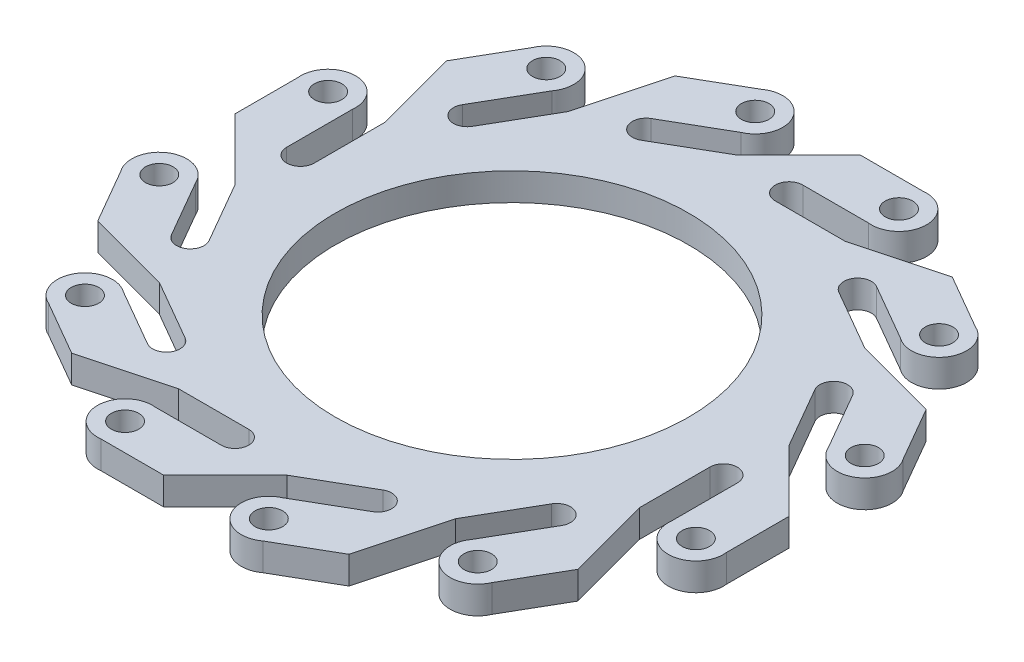
from build123d import *

# Parameters (mm, degrees)
SKETCH_1_R      = 1
SKETCH_1_R_2    = 12.835097572
EXTRUDE_1_DEPTH = 2


with BuildPart() as part:
    # 草图1 → 凸台-拉伸1 (new body)
    with BuildSketch(Plane(origin=(0, 0, 0), x_dir=(1, 0, 0), z_dir=(0, 1, 0))):
        with BuildLine():
            Line((7.150459564, 22.71458211), (2.584896164, 22.71458211))
            Line((2.584896164, 22.71458211), (-1.893440977, 18.236244969))
            Line((-1.893440977, 18.236244969), (-6.310791907, 15.68588622))
            ThreePointArc((-6.310791907, 15.68588622), (-7.676817311, 16.051911624), (-7.310791907, 17.417937028))
            Line((-7.310791907, 17.417937028), (-3.177406319, 19.80434831))
            ThreePointArc((-3.177406319, 19.80434831), (-2.244981501, 22.637541774), (-5.164811424, 23.246634926))
            Line((-5.164811424, 23.246634926), (-9.118705311, 20.963853226))
            Line((-9.118705311, 20.963853226), (-10.757890471, 14.846330924))
            Line((-10.757890471, 14.846330924), (-13.30824922, 10.428979994))
            ThreePointArc((-13.30824922, 10.428979994), (-14.674274623, 10.06295459), (-15.040300027, 11.428979994))
            Line((-15.040300027, 11.428979994), (-12.653888745, 15.562365582))
            ThreePointArc((-12.653888745, 15.562365582), (-13.262981897, 18.482195505), (-16.096175362, 17.549770686))
            Line((-16.096175362, 17.549770686), (-18.378957062, 13.5958768))
            Line((-18.378957062, 13.5958768), (-16.739771901, 7.478354497))
            Line((-16.739771901, 7.478354497), (-16.739771901, 2.377637001))
            ThreePointArc((-16.739771901, 2.377637001), (-17.739771901, 1.377637001), (-18.739771901, 2.377637001))
            Line((-18.739771901, 2.377637001), (-18.739771901, 7.150459564))
            ThreePointArc((-18.739771901, 7.150459564), (-20.727177006, 9.374559877), (-22.71458211, 7.150459564))
            Line((-22.71458211, 7.150459564), (-22.71458211, 2.584896164))
            Line((-22.71458211, 2.584896164), (-18.236244969, -1.893440977))
            Line((-18.236244969, -1.893440977), (-15.68588622, -6.310791907))
            ThreePointArc((-15.68588622, -6.310791907), (-16.051911624, -7.676817311), (-17.417937028, -7.310791907))
            Line((-17.417937028, -7.310791907), (-19.80434831, -3.177406319))
            ThreePointArc((-19.80434831, -3.177406319), (-22.637541774, -2.244981501), (-23.246634926, -5.164811424))
            Line((-23.246634926, -5.164811424), (-20.963853226, -9.118705311))
            Line((-20.963853226, -9.118705311), (-14.846330924, -10.757890471))
            Line((-14.846330924, -10.757890471), (-10.428979994, -13.30824922))
            ThreePointArc((-10.428979994, -13.30824922), (-10.06295459, -14.674274623), (-11.428979994, -15.040300027))
            Line((-11.428979994, -15.040300027), (-15.562365582, -12.653888745))
            ThreePointArc((-15.562365582, -12.653888745), (-18.482195505, -13.262981897), (-17.549770686, -16.096175362))
            Line((-17.549770686, -16.096175362), (-13.5958768, -18.378957062))
            Line((-13.5958768, -18.378957062), (-7.478354497, -16.739771901))
            Line((-7.478354497, -16.739771901), (-2.377637001, -16.739771901))
            ThreePointArc((-2.377637001, -16.739771901), (-1.377637001, -17.739771901), (-2.377637001, -18.739771901))
            Line((-2.377637001, -18.739771901), (-7.150459564, -18.739771901))
            ThreePointArc((-7.150459564, -18.739771901), (-9.374559877, -20.727177006), (-7.150459564, -22.71458211))
            Line((-7.150459564, -22.71458211), (-2.584896164, -22.71458211))
            Line((-2.584896164, -22.71458211), (1.893440977, -18.236244969))
            Line((1.893440977, -18.236244969), (6.310791907, -15.68588622))
            ThreePointArc((6.310791907, -15.68588622), (7.676817311, -16.051911624), (7.310791907, -17.417937028))
            Line((7.310791907, -17.417937028), (3.177406319, -19.80434831))
            ThreePointArc((3.177406319, -19.80434831), (2.244981501, -22.637541774), (5.164811424, -23.246634926))
            Line((5.164811424, -23.246634926), (9.118705311, -20.963853226))
            Line((9.118705311, -20.963853226), (10.757890471, -14.846330924))
            Line((10.757890471, -14.846330924), (13.30824922, -10.428979994))
            ThreePointArc((13.30824922, -10.428979994), (14.674274623, -10.06295459), (15.040300027, -11.428979994))
            Line((15.040300027, -11.428979994), (12.653888745, -15.562365582))
            ThreePointArc((12.653888745, -15.562365582), (13.262981897, -18.482195505), (16.096175362, -17.549770686))
            Line((16.096175362, -17.549770686), (18.378957062, -13.5958768))
            Line((18.378957062, -13.5958768), (16.739771901, -7.478354497))
            Line((16.739771901, -7.478354497), (16.739771901, -2.377637001))
            ThreePointArc((16.739771901, -2.377637001), (17.739771901, -1.377637001), (18.739771901, -2.377637001))
            Line((18.739771901, -2.377637001), (18.739771901, -7.150459564))
            ThreePointArc((18.739771901, -7.150459564), (20.727177006, -9.374559877), (22.71458211, -7.150459564))
            Line((22.71458211, -7.150459564), (22.71458211, -2.584896164))
            Line((22.71458211, -2.584896164), (18.236244969, 1.893440977))
            Line((18.236244969, 1.893440977), (15.68588622, 6.310791907))
            ThreePointArc((15.68588622, 6.310791907), (16.051911624, 7.676817311), (17.417937028, 7.310791907))
            Line((17.417937028, 7.310791907), (19.80434831, 3.177406319))
            ThreePointArc((19.80434831, 3.177406319), (22.637541774, 2.244981501), (23.246634926, 5.164811424))
            Line((23.246634926, 5.164811424), (20.963853226, 9.118705311))
            Line((20.963853226, 9.118705311), (14.846330924, 10.757890471))
            Line((14.846330924, 10.757890471), (10.428979994, 13.30824922))
            ThreePointArc((10.428979994, 13.30824922), (10.06295459, 14.674274623), (11.428979994, 15.040300027))
            Line((11.428979994, 15.040300027), (15.562365582, 12.653888745))
            ThreePointArc((15.562365582, 12.653888745), (18.482195505, 13.262981897), (17.549770686, 16.096175362))
            Line((17.549770686, 16.096175362), (13.5958768, 18.378957062))
            Line((13.5958768, 18.378957062), (7.478354497, 16.739771901))
            Line((7.478354497, 16.739771901), (2.377637001, 16.739771901))
            ThreePointArc((2.377637001, 16.739771901), (1.377637001, 17.739771901), (2.377637001, 18.739771901))
            Line((2.377637001, 18.739771901), (7.150459564, 18.739771901))
            ThreePointArc((7.150459564, 18.739771901), (9.374559877, 20.727177006), (7.150459564, 22.71458211))
        make_face()
        with Locations(Location((7.374559877, 20.727177006, 0), (0, 0, 270))):
            Circle(SKETCH_1_R, mode=Mode.SUBTRACT)
        with Locations(Location((16.750144698, 14.262981897, 0), (0, 0, 270))):
            Circle(SKETCH_1_R, mode=Mode.SUBTRACT)
        with Locations(Location((21.637541774, 3.977032308, 0), (0, 0, 270))):
            Circle(SKETCH_1_R, mode=Mode.SUBTRACT)
        with Locations(Location((20.727177006, -7.374559877, 0), (0, 0, 270))):
            Circle(SKETCH_1_R, mode=Mode.SUBTRACT)
        with Locations(Location((14.262981897, -16.750144698, 0), (0, 0, 270))):
            Circle(SKETCH_1_R, mode=Mode.SUBTRACT)
        with Locations(Location((3.977032308, -21.637541774, 0), (0, 0, 270))):
            Circle(SKETCH_1_R, mode=Mode.SUBTRACT)
        with Locations(Location((-7.374559877, -20.727177006, 0), (0, 0, 270))):
            Circle(SKETCH_1_R, mode=Mode.SUBTRACT)
        with Locations(Location((-16.750144698, -14.262981897, 0), (0, 0, 270))):
            Circle(SKETCH_1_R, mode=Mode.SUBTRACT)
        with Locations(Location((-21.637541774, -3.977032308, 0), (0, 0, 270))):
            Circle(SKETCH_1_R, mode=Mode.SUBTRACT)
        with Locations(Location((-20.727177006, 7.374559877, 0), (0, 0, 270))):
            Circle(SKETCH_1_R, mode=Mode.SUBTRACT)
        with Locations(Location((-14.262981897, 16.750144698, 0), (0, 0, 270))):
            Circle(SKETCH_1_R, mode=Mode.SUBTRACT)
        with Locations(Location((-3.977032308, 21.637541774, 0), (0, 0, 270))):
            Circle(SKETCH_1_R, mode=Mode.SUBTRACT)
        with Locations(Location((0, 0, 0), (0, 0, 270))):
            Circle(SKETCH_1_R_2, mode=Mode.SUBTRACT)
    extrude(amount=EXTRUDE_1_DEPTH)


solid = part.part
